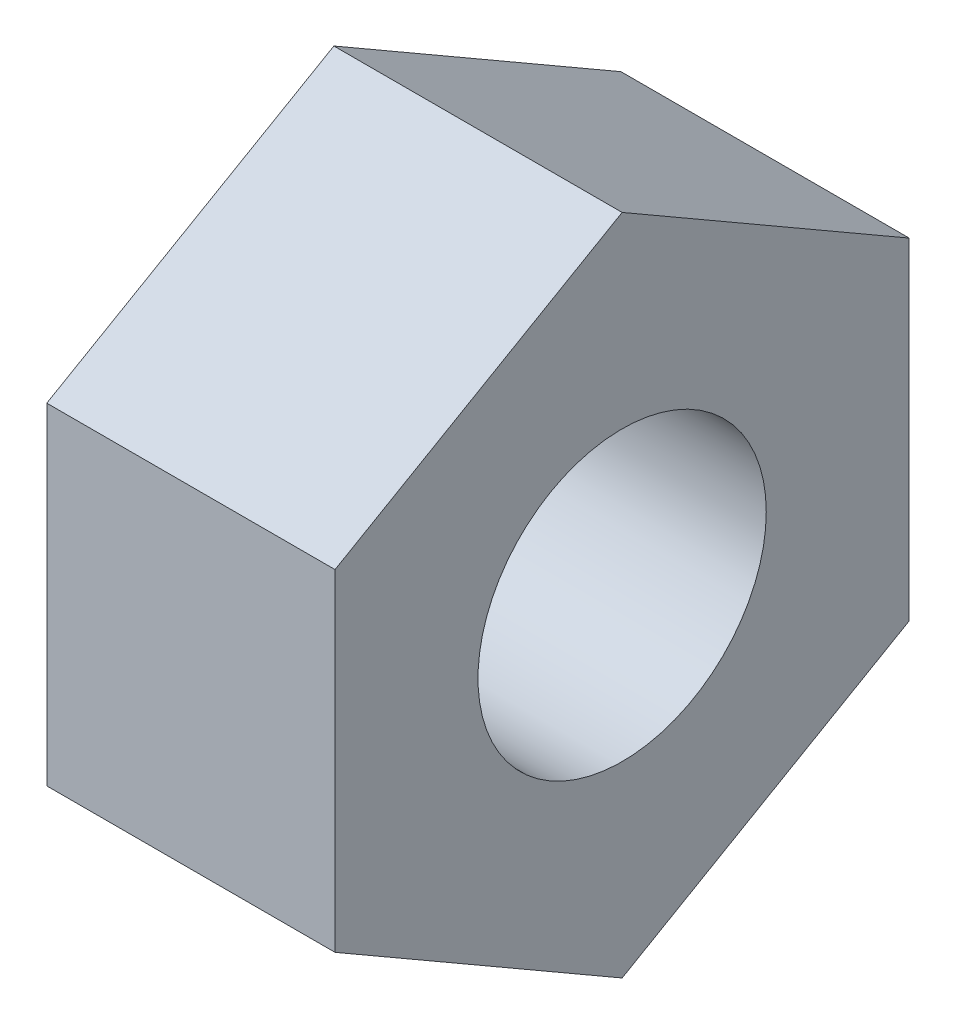
from build123d import *

# Parameters (mm, degrees)
SKETCH1_R           = 5
BOSS_EXTRUDE1_DEPTH = 10


with BuildPart() as part:
    # Sketch1 → Boss-Extrude1 (new body)
    with BuildSketch(Plane.YZ):
        Polygon((11.5, 0), (5.75, 9.959292144), (-5.75, 9.959292144), (-11.5, 0), (-5.75, -9.959292144), (5.75, -9.959292144), align=None)
        with Locations(Location((0, 0, 0), (0, 0, 270))):
            Circle(SKETCH1_R, mode=Mode.SUBTRACT)
    extrude(amount=BOSS_EXTRUDE1_DEPTH)


solid = part.part
